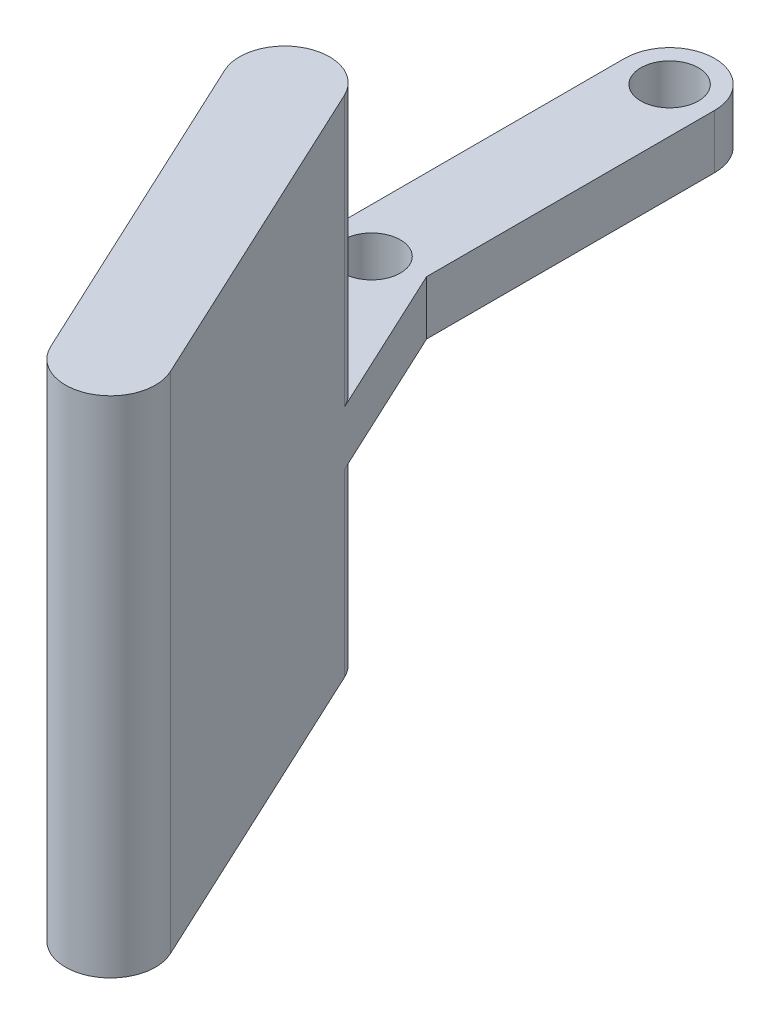
from build123d import *

# Parameters (mm, degrees)
BOSS_EXTRUDE1_DEPTH = 3
BOSS_EXTRUDE2_START = -3
BOSS_EXTRUDE2_DEPTH = 3
SKETCH3_R           = 1.6
CUT_EXTRUDE1_DEPTH  = 49.760896398
BOSS_EXTRUDE3_START = 10
BOSS_EXTRUDE3_DEPTH = 10
BOSS_EXTRUDE4_DEPTH = 15


with BuildPart() as part:
    # Sketch1 → Boss-Extrude1 (new body)
    with BuildSketch(Plane(origin=(0, 0, 0), x_dir=(1, 0, 0), z_dir=(0, 1, 0))):
        with BuildLine():
            Line((2.5, 0), (2.5, -16.552945357))
            ThreePointArc((2.5, -16.552945357), (0, -19.052945357), (-2.5, -16.552945357))
            Line((-2.5, -16.552945357), (-2.5, 0))
            ThreePointArc((-2.5, 0), (0, 2.5), (2.5, 0))
        make_face()
    extrude(amount=BOSS_EXTRUDE1_DEPTH)

    # Sketch2 → Boss-Extrude2 (add)
    with BuildSketch(Plane(origin=(0, 3, 0), x_dir=(1, 0, 0), z_dir=(0, 1, 0)).offset(BOSS_EXTRUDE2_START)):
        with BuildLine():
            Line((2.26545785, -15.495731694), (14.95202181, -42.681225894))
            ThreePointArc((14.95202181, -42.681225894), (13.743777623, -46.003897407), (10.42110611, -44.79565322))
            Line((10.42110611, -44.79565322), (-2.26545785, -17.610159021))
            ThreePointArc((-2.26545785, -17.610159021), (-1.057213663, -14.287487507), (2.26545785, -15.495731694))
        make_face()
    extrude(amount=BOSS_EXTRUDE2_DEPTH)

    # Sketch3 → Cut-Extrude1 (cut, through all)
    with BuildSketch(Plane(origin=(0, 3, 0), x_dir=(1, 0, 0), z_dir=(0, 1, 0))):
        with Locations(Location((0, 0, 0), (0, 0, 270))):
            Circle(SKETCH3_R)
        with Locations(Location((0, -16.552945357, 0), (0, 0, 270))):
            Circle(SKETCH3_R)
    extrude(amount=-CUT_EXTRUDE1_DEPTH, mode=Mode.SUBTRACT)

    # Sketch5 → Boss-Extrude3 (add)
    with BuildSketch(Plane.XZ.offset(BOSS_EXTRUDE3_START)):
        with BuildLine():
            Line((14.95202181, 42.681225894), (6.494312503, 24.557563094))
            ThreePointArc((6.494312503, 24.557563094), (3.171640989, 23.349318908), (1.963396803, 26.671990421))
            Line((1.963396803, 26.671990421), (10.42110611, 44.795653221))
            ThreePointArc((10.42110611, 44.795653221), (13.743777623, 46.003897407), (14.95202181, 42.681225894))
        make_face()
    extrude(amount=-BOSS_EXTRUDE3_DEPTH)

    # Sketch6 → Boss-Extrude4 (add)
    with BuildSketch(Plane(origin=(0, 3, 0), x_dir=(1, 0, 0), z_dir=(0, 1, 0))):
        with BuildLine():
            Line((10.42110611, -44.79565322), (1.963396803, -26.671990421))
            ThreePointArc((1.963396803, -26.671990421), (3.17164099, -23.349318907), (6.494312503, -24.557563094))
            Line((6.494312503, -24.557563094), (14.95202181, -42.681225894))
            ThreePointArc((14.95202181, -42.681225894), (13.743777623, -46.003897407), (10.42110611, -44.79565322))
        make_face()
    extrude(amount=BOSS_EXTRUDE4_DEPTH)


solid = part.part
